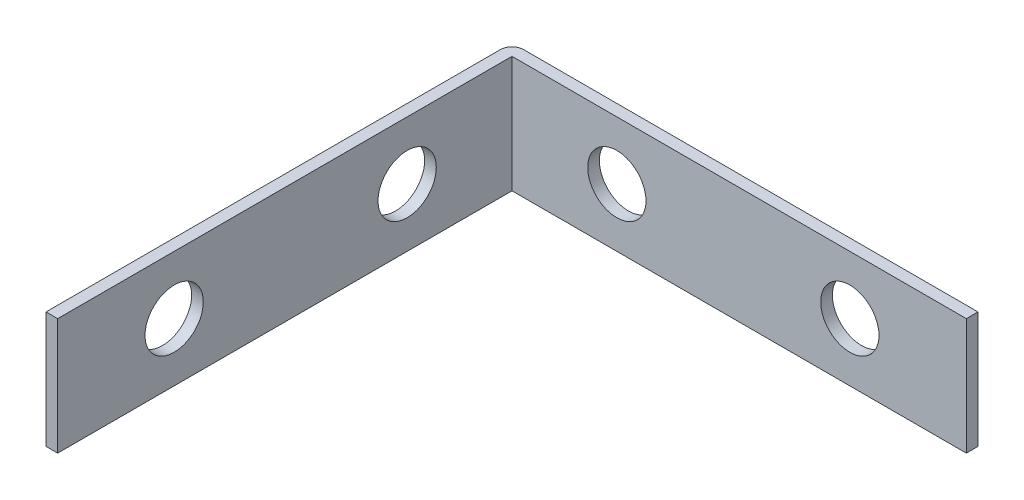
from build123d import *

# Parameters (mm, degrees)
SALIENTE_EXTRUIR1_DEPTH = 10
CROQUIS2_R              = 2.5
CORTAR_EXTRUIR1_DEPTH   = 1
CROQUIS3_R              = 2.5
CORTAR_EXTRUIR2_DEPTH   = 1


with BuildPart() as part:
    # Croquis1 → Saliente-Extruir1 (new body)
    with BuildSketch(Plane(origin=(0, 0, 0), x_dir=(1, 0, 0), z_dir=(0, 1, 0))):
        with BuildLine():
            ThreePointArc((-25.446754953, 16.759256359), (-25.153861734, 17.46636314), (-24.446754953, 17.759256359))
            Line((-24.446754953, 17.759256359), (14.553245047, 17.759256359))
            Line((14.553245047, 17.759256359), (14.553245047, 16.759256359))
            Line((14.553245047, 16.759256359), (-24.446754953, 16.759256359))
            Line((-24.446754953, 16.759256359), (-24.446754953, -22.240743641))
            Line((-24.446754953, -22.240743641), (-25.446754953, -22.240743641))
            Line((-25.446754953, -22.240743641), (-25.446754953, 16.759256359))
        make_face()
    extrude(amount=SALIENTE_EXTRUIR1_DEPTH)

    # Croquis2 → Cortar-Extruir1 (cut)
    with BuildSketch(Plane.XY.offset(-16.759256359)):
        with Locations((4.553245047, 5)):
            Circle(CROQUIS2_R)
        with Locations((-15.446754953, 5)):
            Circle(CROQUIS2_R)
    extrude(amount=-CORTAR_EXTRUIR1_DEPTH, mode=Mode.SUBTRACT)

    # Croquis3 → Cortar-Extruir2 (cut)
    with BuildSketch(Plane(origin=(-24.446754953, 0, 0), x_dir=(0, 0, -1), z_dir=(1, 0, 0))):
        with Locations((-12.240743641, 5)):
            Circle(CROQUIS3_R)
        with Locations((7.759256359, 5)):
            Circle(CROQUIS3_R)
    extrude(amount=-CORTAR_EXTRUIR2_DEPTH, mode=Mode.SUBTRACT)


solid = part.part
